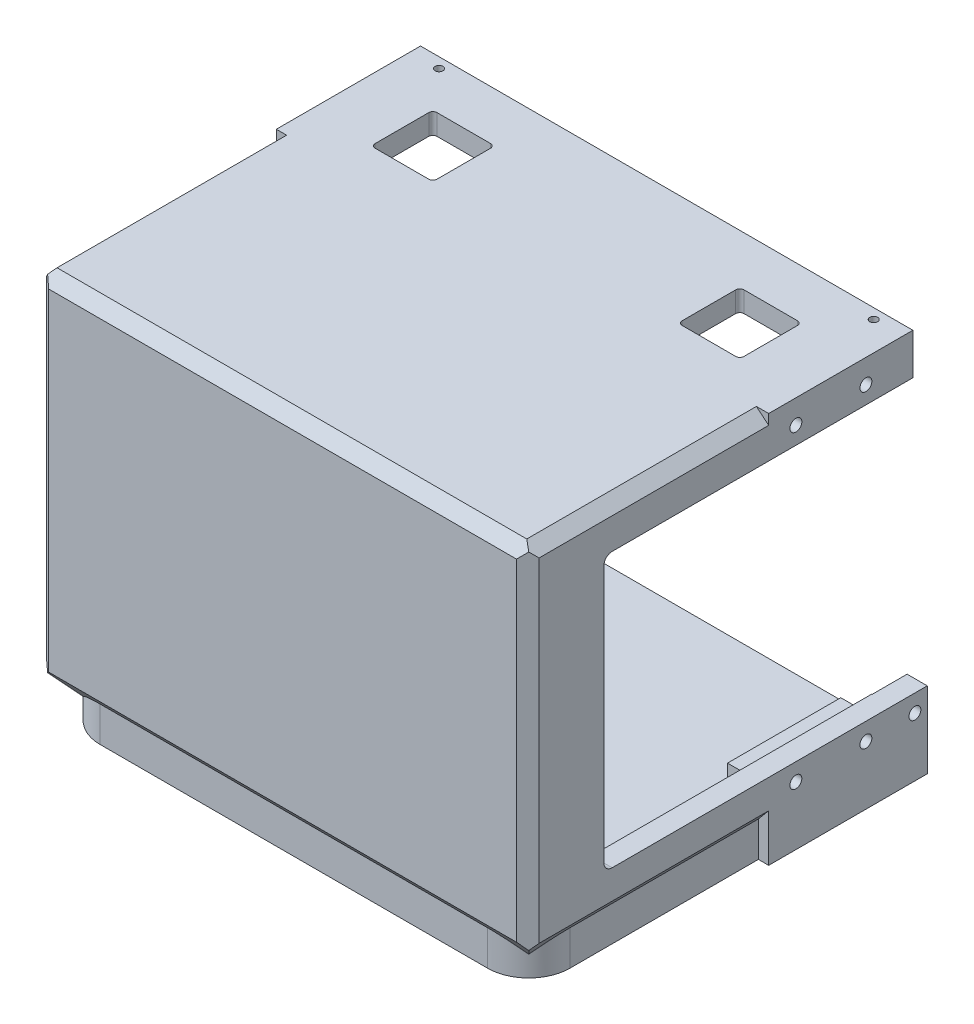
from build123d import *
from OCP.BRepFilletAPI import BRepFilletAPI_MakeChamfer

# Parameters (mm, degrees)
SKETCH1_W                                  = 119.52
SKETCH1_H                                  = 86.5
BOSS_EXTRUDE1_DEPTH                        = 88.24
SHELL1_T                                   = -5
CHAMFER1_SIZE                              = 2.5
CHAMFER1_SIZE2                             = 2.979383981
CHAMFER2_SIZE                              = 2.5
CHAMFER2_SIZE2                             = 2.979383981
CHAMFER3_SIZE                              = 2.5
CHAMFER3_SIZE2                             = 2.979383981
CUT_EXTRUDE1_REACH                         = 156.732
SKETCH3_W                                  = 70
SKETCH3_H                                  = 66.5
FILLET1_R                                  = 2
FILLET1_OF_MIRROR1_R                       = 2
SKETCH4_W                                  = 109.52
SKETCH4_H                                  = 5
BOSS_EXTRUDE2_DEPTH                        = 5
CUT_EXTRUDE2_REACH                         = 139.258
SKETCH5_R                                  = 0.95
BOSS_EXTRUDE3_DEPTH                        = 8.5
BOSS_EXTRUDE4_DEPTH                        = 5
BOSS_EXTRUDE6_DEPTH                        = 35
BOSS_EXTRUDE7_DEPTH                        = 8.5
BOSS_EXTRUDE8_DEPTH                        = 35
BOSS_EXTRUDE9_DEPTH                        = 38.5
SKETCH16_W                                 = 5
SKETCH16_H                                 = 27.5
BOSS_EXTRUDE10_DEPTH                       = 3
MIRROR7_COPY_1_SKETCH_W                    = 5
MIRROR7_COPY_1_SKETCH_H                    = 27.5
MIRROR7_COPY_1_DEPTH                       = 3
SKETCH15_R                                 = 1.45
CUT_EXTRUDE5_DEPTH                         = 8
MIRROR8_AT_THE_SECOND_PLANE_COPY_1_SKETC_R = 1.45
MIRROR8_AT_THE_SECOND_PLANE_COPY_1_DEPTH   = 8
SKETCH17_R                                 = 1.45
CUT_EXTRUDE6_DEPTH                         = 8
SKETCH18_R                                 = 1.45
CUT_EXTRUDE7_DEPTH                         = 8
SKETCH19_W                                 = 15
SKETCH19_H                                 = 15
CUT_EXTRUDE8_DEPTH                         = 5
FILLET2_R                                  = 1
FILLET2_OF_MIRROR10_R                      = 1
BOSS_EXTRUDE11_DEPTH                       = 8.5
FILLET3_R                                  = 10


with BuildPart() as part:
    # Sketch1 → Boss-Extrude1 (new body)
    with BuildSketch(Plane.XY):
        Rectangle(SKETCH1_W, SKETCH1_H)
    extrude(amount=BOSS_EXTRUDE1_DEPTH)

    # Shell1
    shell1_openings = [part.faces().sort_by_distance(p)[0] for p in [
        (0, 0, 0),
    ]]
    offset(amount=SHELL1_T, openings=shell1_openings, kind=Kind.INTERSECTION)

    # Chamfer1: one chamfer whose edges measure the first distance from different faces: ONE call of the kernel's chamfer builder (chamfer() names one face for all edges)
    chamfer1_edges_1 = [part.edges().sort_by_distance(p)[0] for p in [
        (59.76, 0, 88.24),
    ]]
    chamfer1_side_1 = [part.faces().sort_by_distance(p)[0] for p in [
        (59.76, 0, 44.12),
    ]]
    chamfer1_edges_2 = [part.edges().sort_by_distance(p)[0] for p in [
        (0, 43.25, 88.24),
    ]]
    chamfer1_side_2 = [part.faces().sort_by_distance(p)[0] for p in [
        (0, 43.25, 44.12),
    ]]
    chamfer1_edges_3 = [part.edges().sort_by_distance(p)[0] for p in [
        (-59.76, 0, 88.24),
    ]]
    chamfer1_side_3 = [part.faces().sort_by_distance(p)[0] for p in [
        (-59.76, 0, 44.12),
    ]]
    chamfer1_edges_4 = [part.edges().sort_by_distance(p)[0] for p in [
        (0, -43.25, 88.24),
    ]]
    chamfer1_side_4 = [part.faces().sort_by_distance(p)[0] for p in [
        (0, -43.25, 44.12),
    ]]
    chamfer1 = BRepFilletAPI_MakeChamfer(part.part.solid().wrapped)
    for e in chamfer1_edges_1:
        chamfer1.Add(CHAMFER1_SIZE, CHAMFER1_SIZE2, e.wrapped, chamfer1_side_1[0].wrapped)  # the first distance lies on this face
    for e in chamfer1_edges_2:
        chamfer1.Add(CHAMFER1_SIZE, CHAMFER1_SIZE2, e.wrapped, chamfer1_side_2[0].wrapped)  # the first distance lies on this face
    for e in chamfer1_edges_3:
        chamfer1.Add(CHAMFER1_SIZE, CHAMFER1_SIZE2, e.wrapped, chamfer1_side_3[0].wrapped)  # the first distance lies on this face
    for e in chamfer1_edges_4:
        chamfer1.Add(CHAMFER1_SIZE, CHAMFER1_SIZE2, e.wrapped, chamfer1_side_4[0].wrapped)  # the first distance lies on this face
    add(Compound.cast(chamfer1.Shape()), mode=Mode.REPLACE)

    # Chamfer2
    chamfer2_edges = [part.edges().sort_by_distance(p)[0] for p in [
        (-59.76, 43.25, 42.87),
    ]]
    chamfer2_side = [part.faces().sort_by_distance(p)[0] for p in [
        (0, 43.25, 42.87),
    ]]
    chamfer(chamfer2_edges, length=CHAMFER2_SIZE, length2=CHAMFER2_SIZE2, reference=chamfer2_side[0])

    # Chamfer3: one chamfer whose edges measure the first distance from different faces: ONE call of the kernel's chamfer builder (chamfer() names one face for all edges)
    chamfer3_edges_1 = [part.edges().sort_by_distance(p)[0] for p in [
        (59.76, -43.25, 42.87),
    ]]
    chamfer3_side_1 = [part.faces().sort_by_distance(p)[0] for p in [
        (0, -43.25, 42.87),
    ]]
    chamfer3_edges_2 = [part.edges().sort_by_distance(p)[0] for p in [
        (-59.76, -43.25, 42.87),
    ]]
    chamfer3_side_2 = [part.faces().sort_by_distance(p)[0] for p in [
        (-59.76, -1.489691991, 42.87),
    ]]
    chamfer3_edges_3 = [part.edges().sort_by_distance(p)[0] for p in [
        (59.76, 43.25, 42.87),
    ]]
    chamfer3_side_3 = [part.faces().sort_by_distance(p)[0] for p in [
        (59.76, 0, 42.87),
    ]]
    chamfer3 = BRepFilletAPI_MakeChamfer(part.part.solid().wrapped)
    for e in chamfer3_edges_1:
        chamfer3.Add(CHAMFER3_SIZE, CHAMFER3_SIZE2, e.wrapped, chamfer3_side_1[0].wrapped)  # the first distance lies on this face
    for e in chamfer3_edges_2:
        chamfer3.Add(CHAMFER3_SIZE, CHAMFER3_SIZE2, e.wrapped, chamfer3_side_2[0].wrapped)  # the first distance lies on this face
    for e in chamfer3_edges_3:
        chamfer3.Add(CHAMFER3_SIZE, CHAMFER3_SIZE2, e.wrapped, chamfer3_side_3[0].wrapped)  # the first distance lies on this face
    add(Compound.cast(chamfer3.Shape()), mode=Mode.REPLACE)

    # Sketch3 → Cut-Extrude1 (cut, up to next)
    with BuildSketch(Plane(origin=(59.76, 0, 0), x_dir=(0, 0, -1), z_dir=(1, 0, 0)), mode=Mode.PRIVATE) as cut_extrude1_sk1:
        with Locations((-35, 0)):
            Rectangle(SKETCH3_W, SKETCH3_H)
    cut_extrude1_tool1 = extrude(cut_extrude1_sk1.sketch, amount=-CUT_EXTRUDE1_REACH, mode=Mode.PRIVATE) & part.part
    cut_extrude1 = cut_extrude1_tool1.solids().sort_by_distance((59.76, 0, 35))[0]
    add(cut_extrude1, mode=Mode.SUBTRACT)

    # Fillet1
    fillet1_edges = [part.edges().sort_by_distance(p)[0] for p in [
        (57.26, -33.25, 70),
        (57.26, 33.25, 70),
    ]]
    fillet(fillet1_edges, radius=FILLET1_R)

    # Mirror1: Cut-Extrude1 across plane
    add(cut_extrude1.mirror(Plane(origin=(0, 0, 0), x_dir=(0, 0, 1), z_dir=(1, 0, 0))), mode=Mode.SUBTRACT)

    # Fillet1 of Mirror1
    fillet1_of_mirror1_edges = [part.edges().sort_by_distance(p)[0] for p in [
        (-57.26, -33.25, 70),
        (-57.26, 33.25, 70),
    ]]
    fillet(fillet1_of_mirror1_edges, radius=FILLET1_OF_MIRROR1_R)

    # Sketch4 → Boss-Extrude2 (add)
    with BuildSketch(Plane(origin=(0, 0, 0), x_dir=(-1, 0, 0), z_dir=(0, 0, -1))):
        with Locations((0, 40.75)):
            Rectangle(SKETCH4_W, SKETCH4_H)
    extrude(amount=BOSS_EXTRUDE2_DEPTH)

    # Sketch5 → Cut-Extrude2 (cut, up to next)
    with BuildSketch(Plane(origin=(0, 43.25, 0), x_dir=(1, 0, 0), z_dir=(0, 1, 0)), mode=Mode.PRIVATE) as cut_extrude2_sk1:
        with Locations(Location((-52.76, 2.5, 0), (0, 0, 270))):
            Circle(SKETCH5_R)
    cut_extrude2_tool1 = extrude(cut_extrude2_sk1.sketch, amount=-CUT_EXTRUDE2_REACH, mode=Mode.PRIVATE) & part.part
    # Sketch5 → Cut-Extrude2 (cut, up to next)
    with BuildSketch(Plane(origin=(0, 43.25, 0), x_dir=(1, 0, 0), z_dir=(0, 1, 0)), mode=Mode.PRIVATE) as cut_extrude2_sk2:
        with Locations(Location((52.76, 2.5, 0), (0, 0, 270))):
            Circle(SKETCH5_R)
    cut_extrude2_tool2 = extrude(cut_extrude2_sk2.sketch, amount=-CUT_EXTRUDE2_REACH, mode=Mode.PRIVATE) & part.part
    add(cut_extrude2_tool1.solids().sort_by_distance((-52.76, 43.25, -2.5))[0], mode=Mode.SUBTRACT)
    add(cut_extrude2_tool2.solids().sort_by_distance((52.76, 43.25, -2.5))[0], mode=Mode.SUBTRACT)

    # Sketch6 → Boss-Extrude3 (add)
    with BuildSketch(Plane(origin=(0, 0, 0), x_dir=(-1, 0, 0), z_dir=(0, 0, -1))):
        Polygon((-59.76, -33.25), (-54.86, -33.25), (-54.86, -43.25), (-57.26, -43.25), (-59.76, -40.270616019), align=None)
    extrude(amount=BOSS_EXTRUDE3_DEPTH)

    # Sketch8 → Boss-Extrude4 (add)
    with BuildSketch(Plane(origin=(0, 0, 0), x_dir=(-1, 0, 0), z_dir=(0, 0, -1))):
        Polygon((57.26, 43.25), (54.76, 43.25), (54.76, 38.25), (54.76, 33.25), (59.76, 33.25), (59.76, 40.270616019), align=None)
        Polygon((-54.76, 33.25), (-54.76, 38.25), (-54.76, 43.25), (-56.780616019, 43.25), (-59.76, 40.75), (-59.76, 33.25), align=None)
    extrude(amount=BOSS_EXTRUDE4_DEPTH)

    # Sketch10 → Boss-Extrude6 (add)
    with BuildSketch(Plane(origin=(0, 0, -5), x_dir=(-1, 0, 0), z_dir=(0, 0, -1))):
        Polygon((-59.76, 40.75), (-59.76, 43.25), (-56.780616019, 43.25), align=None)
    extrude(amount=-BOSS_EXTRUDE6_DEPTH)

    # Sketch11 → Boss-Extrude7 (add)
    with BuildSketch(Plane(origin=(0, 0, 0), x_dir=(-1, 0, 0), z_dir=(0, 0, -1))):
        Polygon((59.76, -33.25), (54.86, -33.25), (54.86, -43.25), (56.780616019, -43.25), (59.76, -40.75), align=None)
    extrude(amount=BOSS_EXTRUDE7_DEPTH)

    # Sketch13 → Boss-Extrude8 (add)
    with BuildSketch(Plane(origin=(0, 0, -5), x_dir=(-1, 0, 0), z_dir=(0, 0, -1))):
        Polygon((57.26, 43.25), (59.76, 43.25), (59.76, 40.270616019), align=None)
    extrude(amount=-BOSS_EXTRUDE8_DEPTH)

    # Sketch14 → Boss-Extrude9 (add)
    with BuildSketch(Plane(origin=(0, 0, -8.5), x_dir=(-1, 0, 0), z_dir=(0, 0, -1))):
        Polygon((-59.76, -40.270616019), (-59.76, -43.25), (-57.26, -43.25), align=None)
        Polygon((59.76, -40.75), (59.76, -43.25), (56.780616019, -43.25), align=None)
    extrude(amount=-BOSS_EXTRUDE9_DEPTH)

    # Sketch16 → Boss-Extrude10 (add)
    with BuildSketch(Plane.XZ.offset(-38.25)):
        with Locations((52.26, 16.25)):
            Rectangle(SKETCH16_W, SKETCH16_H)
    boss_extrude10 = extrude(amount=BOSS_EXTRUDE10_DEPTH)

    # Mirror6: Boss-Extrude10 across plane
    add(boss_extrude10.mirror(Plane(origin=(0, 0, 0), x_dir=(0, 0, 1), z_dir=(1, 0, 0))))

    # Mirror7: Boss-Extrude10 across plane
    add(boss_extrude10.mirror(Plane.ZX))

    # Mirror7 copy 1 sketch → Mirror7 copy 1 (add)
    with BuildSketch(Plane(origin=(0, -38.25, 0), x_dir=(-1, 0, 0), z_dir=(0, 1, 0))):
        with Locations((52.26, 16.25)):
            Rectangle(MIRROR7_COPY_1_SKETCH_W, MIRROR7_COPY_1_SKETCH_H)
    extrude(amount=MIRROR7_COPY_1_DEPTH)

    # Sketch15 → Cut-Extrude5 (cut)
    with BuildSketch(Plane(origin=(59.76, 0, 0), x_dir=(0, 0, -1), z_dir=(1, 0, 0))):
        with Locations((-6.4, 37.5)):
            Circle(SKETCH15_R)
        with Locations((-23.4, 37.5)):
            Circle(SKETCH15_R)
    cut_extrude5 = extrude(amount=-CUT_EXTRUDE5_DEPTH, mode=Mode.SUBTRACT)

    # Mirror8: Cut-Extrude5 across plane
    add(cut_extrude5.mirror(Plane.ZX), mode=Mode.SUBTRACT)

    # Mirror8 at the second plane: Cut-Extrude5 across plane
    add(cut_extrude5.mirror(Plane(origin=(0, 0, 0), x_dir=(0, 0, 1), z_dir=(1, 0, 0))), mode=Mode.SUBTRACT)

    # Mirror8 at the second plane copy 1 sketc → Mirror8 at the second plane copy 1 (cut)
    with BuildSketch(Plane(origin=(-59.76, 0, 0), x_dir=(0, 0, -1), z_dir=(-1, 0, 0))):
        with Locations((-6.4, 37.5)):
            Circle(MIRROR8_AT_THE_SECOND_PLANE_COPY_1_SKETC_R)
        with Locations((-23.4, 37.5)):
            Circle(MIRROR8_AT_THE_SECOND_PLANE_COPY_1_SKETC_R)
    extrude(amount=-MIRROR8_AT_THE_SECOND_PLANE_COPY_1_DEPTH, mode=Mode.SUBTRACT)

    # Sketch17 → Cut-Extrude6 (cut)
    with BuildSketch(Plane(origin=(59.76, 0, 0), x_dir=(0, 0, -1), z_dir=(1, 0, 0))):
        with Locations((5.5, -37.5)):
            Circle(SKETCH17_R)
    extrude(amount=-CUT_EXTRUDE6_DEPTH, mode=Mode.SUBTRACT)

    # Sketch18 → Cut-Extrude7 (cut)
    with BuildSketch(Plane(origin=(-54.86, 0, 0), x_dir=(0, 0, -1), z_dir=(1, 0, 0))):
        with Locations((5.5, -37.5)):
            Circle(SKETCH18_R)
    extrude(amount=-CUT_EXTRUDE7_DEPTH, mode=Mode.SUBTRACT)

    # Sketch19 → Cut-Extrude8 (cut)
    with BuildSketch(Plane(origin=(0, 43.25, 0), x_dir=(1, 0, 0), z_dir=(0, 1, 0))):
        with Locations((-37.26, -14.5)):
            Rectangle(SKETCH19_W, SKETCH19_H)
    cut_extrude8 = extrude(amount=-CUT_EXTRUDE8_DEPTH, mode=Mode.SUBTRACT)

    # Fillet2
    fillet2_edges = [part.edges().sort_by_distance(p)[0] for p in [
        (-44.76, 40.75, 22),
        (-44.76, 40.75, 7),
        (-29.76, 40.75, 7),
        (-29.76, 40.75, 22),
    ]]
    fillet(fillet2_edges, radius=FILLET2_R)

    # Mirror10: Cut-Extrude8 across plane
    add(cut_extrude8.mirror(Plane(origin=(0, 0, 0), x_dir=(0, 0, 1), z_dir=(1, 0, 0))), mode=Mode.SUBTRACT)

    # Fillet2 of Mirror10
    fillet2_of_mirror10_edges = [part.edges().sort_by_distance(p)[0] for p in [
        (44.76, 40.75, 22),
        (44.76, 40.75, 7),
        (29.76, 40.75, 7),
        (29.76, 40.75, 22),
    ]]
    fillet(fillet2_of_mirror10_edges, radius=FILLET2_OF_MIRROR10_R)

    # Sketch20 → Boss-Extrude11 (add)
    with BuildSketch(Plane.XZ.offset(43.25)):
        Polygon((-56.780616019, 85.74), (57.26, 85.74), (57.26, 30), (59.76, 30), (59.76, 0), (59.76, -8.5), (54.86, -8.5), (54.86, 0), (-54.86, 0), (-54.86, -8.5), (-59.76, -8.5), (-59.76, 0), (-59.76, 30), (-56.780616019, 30), align=None)
    extrude(amount=BOSS_EXTRUDE11_DEPTH)

    # Fillet3
    fillet3_edges = [part.edges().sort_by_distance(p)[0] for p in [
        (-56.780616019, -47.5, 85.74),
        (57.26, -47.5, 85.74),
    ]]
    fillet(fillet3_edges, radius=FILLET3_R)


solid = part.part
